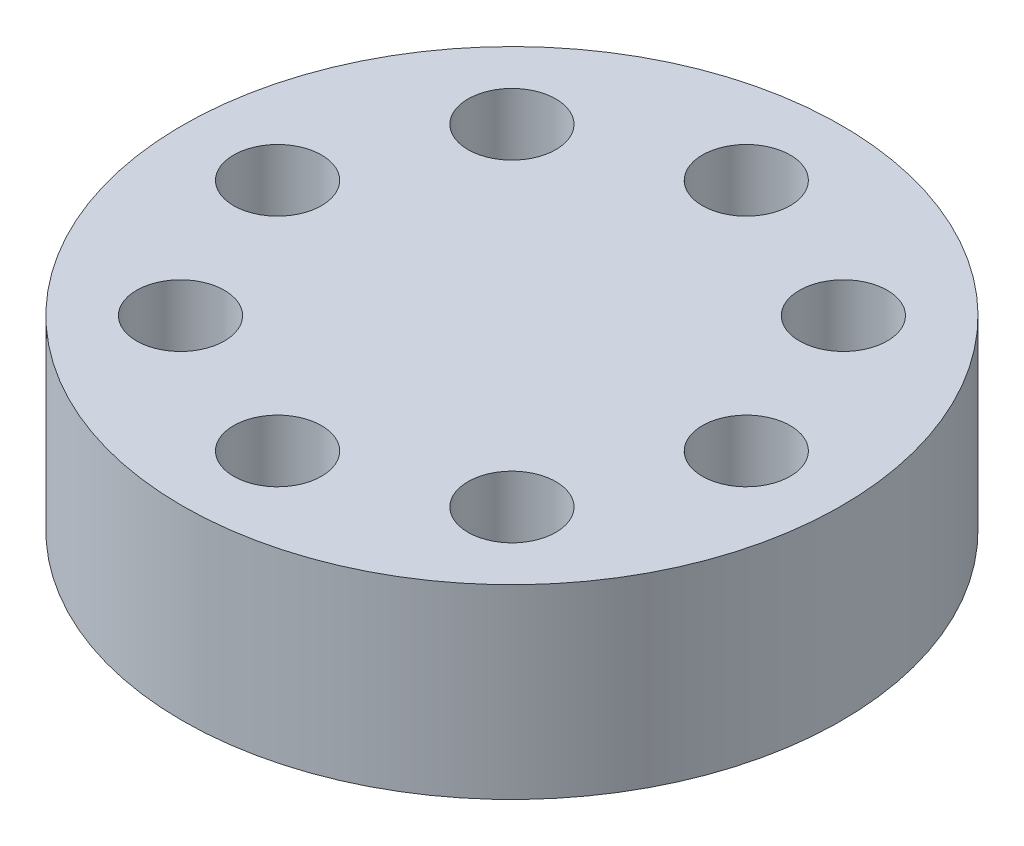
from build123d import *

# Parameters (mm, degrees)
SKETCH1_R           = 22.5
BOSS_EXTRUDE1_DEPTH = 12.7
SKETCH2_R           = 3
CUT_EXTRUDE1_DEPTH  = 35.260618792


with BuildPart() as part:
    # Sketch1 → Boss-Extrude1 (new body)
    with BuildSketch(Plane(origin=(0, 0, 0), x_dir=(1, 0, 0), z_dir=(0, 1, 0))):
        with Locations(Location((0, 0, 0), (0, 0, 270))):
            Circle(SKETCH1_R)
    extrude(amount=BOSS_EXTRUDE1_DEPTH)

    # Sketch2 → Cut-Extrude1 (cut, through all)
    with BuildSketch(Plane(origin=(0, 12.7, 0), x_dir=(1, 0, 0), z_dir=(0, 1, 0))):
        with Locations(Location((-16, 0, 0), (0, 0, 270))):
            Circle(SKETCH2_R)
        with Locations(Location((-11.313708499, 11.313708499, 0), (0, 0, 270))):
            Circle(SKETCH2_R)
        with Locations(Location((0, 16, 0), (0, 0, 270))):
            Circle(SKETCH2_R)
        with Locations(Location((11.313708499, 11.313708499, 0), (0, 0, 270))):
            Circle(SKETCH2_R)
        with Locations(Location((16, 0, 0), (0, 0, 270))):
            Circle(SKETCH2_R)
        with Locations(Location((11.313708499, -11.313708499, 0), (0, 0, 270))):
            Circle(SKETCH2_R)
        with Locations(Location((0, -16, 0), (0, 0, 270))):
            Circle(SKETCH2_R)
        with Locations(Location((-11.313708499, -11.313708499, 0), (0, 0, 270))):
            Circle(SKETCH2_R)
    extrude(amount=-CUT_EXTRUDE1_DEPTH, mode=Mode.SUBTRACT)


solid = part.part
